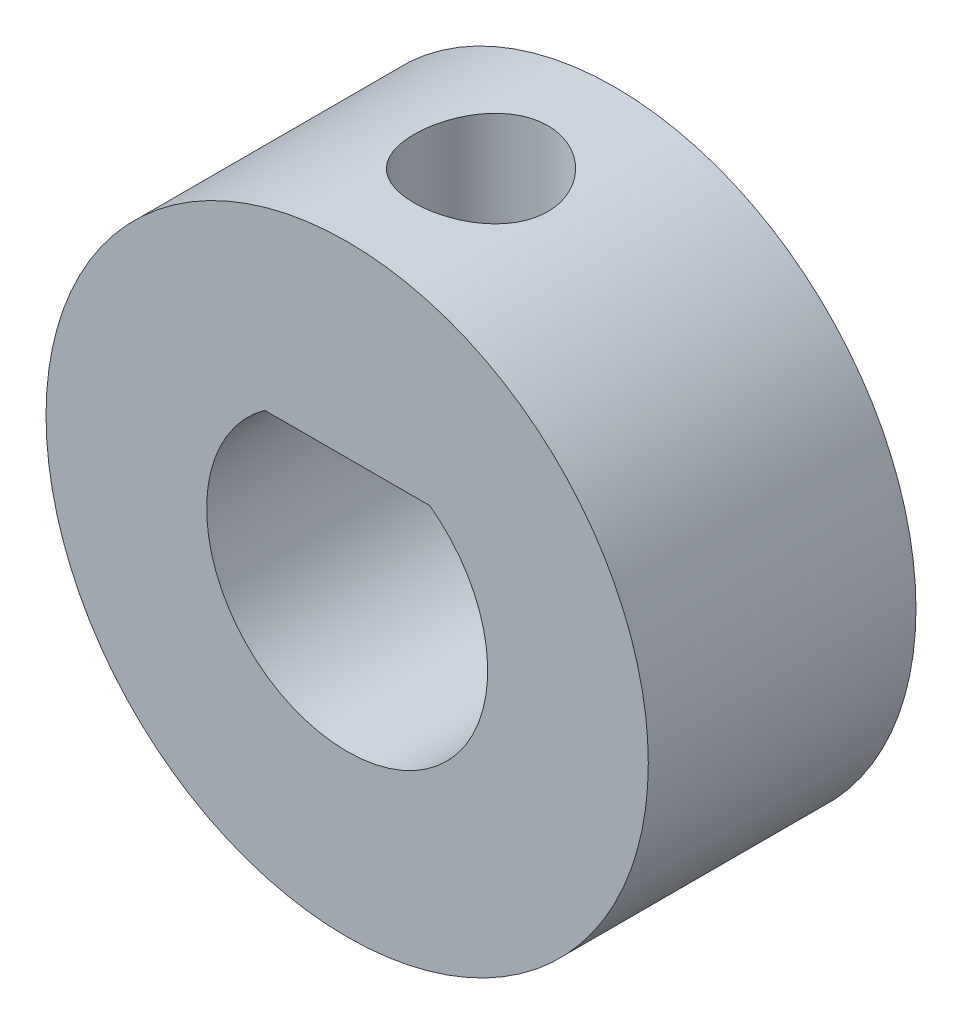
from build123d import *

# Parameters (mm, degrees)
SKETCH_1_R          = 4.5
EXTRUDE_1_DEPTH     = 4
SKETCH_2_R          = 1
CUT_EXTRUDE_1_DEPTH = 8.516648189


with BuildPart() as part:
    # 草图1 → 凸台-拉伸1 (new body)
    with BuildSketch(Plane.XY):
        Circle(SKETCH_1_R)
        with BuildLine():
            Line((-1.232882801, 1.7), (1.232882801, 1.7))
            ThreePointArc((1.232882801, 1.7), (0, -2.1), (-1.232882801, 1.7))
        make_face(mode=Mode.SUBTRACT)
    extrude(amount=EXTRUDE_1_DEPTH)

    # 草图2 → 切除-拉伸1 (cut, through all)
    with BuildSketch(Plane(origin=(0, 0, 0), x_dir=(1, 0, 0), z_dir=(0, 1, 0))):
        with Locations(Location((0, -2, 0), (0, 0, 90))):
            Circle(SKETCH_2_R)
    extrude(amount=CUT_EXTRUDE_1_DEPTH, mode=Mode.SUBTRACT)


solid = part.part
